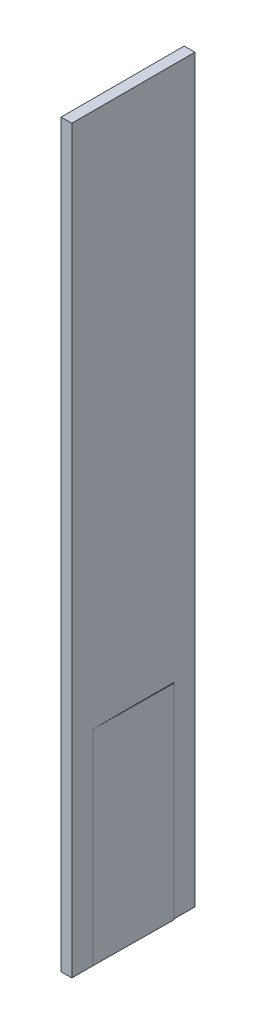
from build123d import *

# Parameters (mm, degrees)
SKETCH1_W           = 101.6
SKETCH1_H           = 1168.4
BOSS_EXTRUDE1_DEPTH = 7023.1
SKETCH3_W           = 762
SKETCH3_H           = 1944.654801242
CUT_EXTRUDE2_DEPTH  = 7049.088096073
BOSS_EXTRUDE2_DEPTH = 1944.654801242


with BuildPart() as part:
    # Sketch1 → Boss-Extrude1 (new body)
    with BuildSketch(Plane(origin=(0, 0, 0), x_dir=(1, 0, 0), z_dir=(0, 1, 0))):
        Rectangle(SKETCH1_W, SKETCH1_H)
    extrude(amount=BOSS_EXTRUDE1_DEPTH)

    # Sketch3 → Cut-Extrude2 (cut, through all)
    with BuildSketch(Plane(origin=(50.8, 0, 0), x_dir=(0, 0, -1), z_dir=(1, 0, 0))):
        with Locations((0, 972.327400621)):
            Rectangle(SKETCH3_W, SKETCH3_H)
    extrude(amount=-CUT_EXTRUDE2_DEPTH, mode=Mode.SUBTRACT)


with BuildPart() as body_2:
    # Sketch8 → Boss-Extrude2 (new body)
    with BuildSketch(Plane.XZ.offset(-1944.654801242)):
        Polygon((50.8, 381), (57.44962005, -380.970985375), (-31.446994911, -381.746774381), (-38.09661496, 380.224210994), align=None)
    extrude(amount=BOSS_EXTRUDE2_DEPTH)


solid = Compound([part.part, body_2.part])
